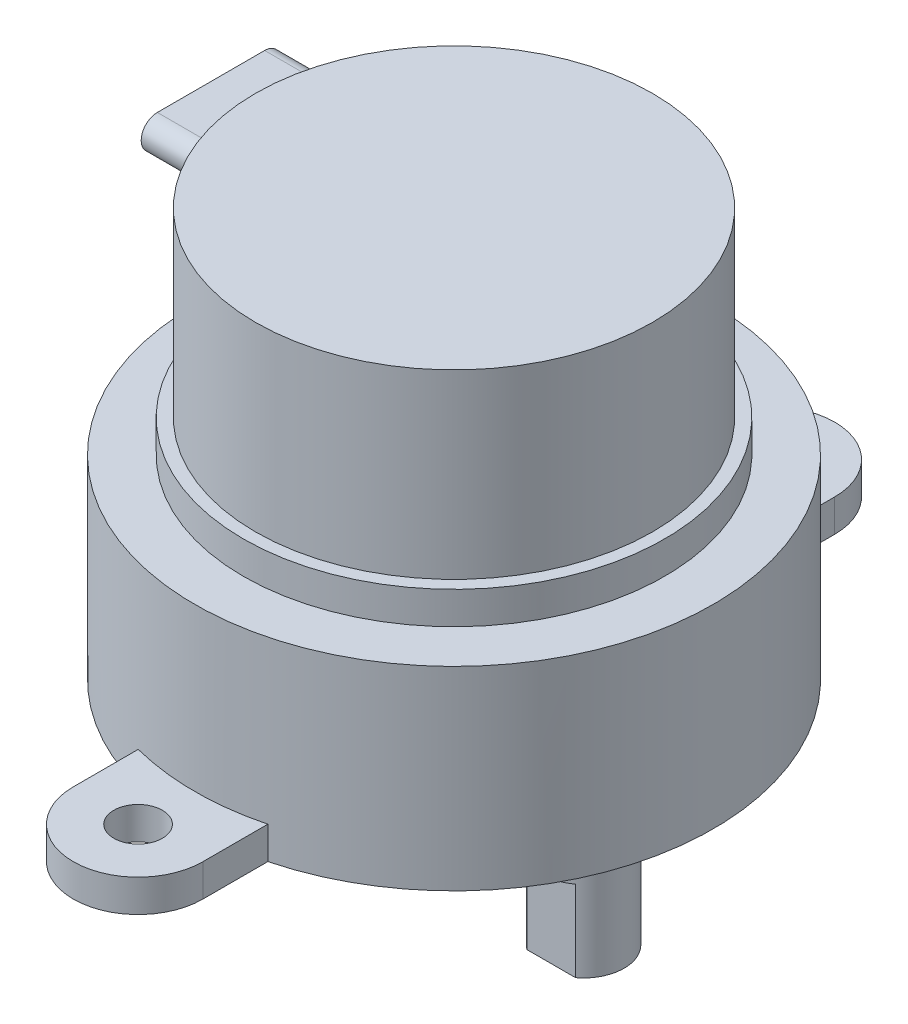
from build123d import *

# Parameters (mm, degrees)
SKETCH_9_W          = 5.698212476
SKETCH_9_H          = 1.620294685
SKETCH_9_W_2        = 7.400009417
SKETCH_9_H_2        = 3.482357373
CUT_EXTRUDE_1_DEPTH = 5
SKETCH_10_R         = 1.5
EXTRUDE_5_DEPTH     = 2
EXTRUDE_6_DEPTH     = 15


with BuildPart() as part:
    # 草图3 → 旋转1 (revolve)
    with BuildSketch(Plane.XY, mode=Mode.PRIVATE) as revolve_1_sk:
        Polygon((-16, 0), (-16, 12), (-13, 12), (-13, 14), (-12.25, 14), (-12.25, 25.2), (0, 25.2), (0, 0), align=None)
    revolve(revolve_1_sk.sketch.rotate(Axis((0, 0, 0), (0, 1, 0)), 270), axis=Axis((0, 0, 0), (0, 1, 0)))



with BuildPart() as body_2:
    # 草图6 → 旋转4 (revolve)
    with BuildSketch(Plane.XY):
        Polygon((3.5, 0), (3.5, -1.25), (4, -1.25), (4, -2.7), (5.5, -2.7), (5.5, -10.2), (8, -10.2), (8, -5.2), (8, 0), align=None)
    revolve(axis=Axis((8, 0, 0), (0, -1, 0)))

    # 草图8 → M3 螺纹孔1 (revolve, cut)
    with BuildSketch(Plane(origin=(8, -10.2, 0), x_dir=(0, 0, -1), z_dir=(1, 0, 0))):
        Polygon((0, 0), (0, 8.251075774), (1.25, 7.5), (1.25, 0), align=None)
    revolve(axis=Axis((8, -16.55, 0), (0, 1, 0)), mode=Mode.SUBTRACT)

    # 草图9 → 切除-拉伸1 (cut)
    with BuildSketch(Plane.XZ.offset(10.2)):
        with Locations((8.176379841, 2.810147343)):
            Rectangle(SKETCH_9_W, SKETCH_9_H)
        with Locations((7.325481371, -3.741178687)):
            Rectangle(SKETCH_9_W_2, SKETCH_9_H_2)
    extrude(amount=-CUT_EXTRUDE_1_DEPTH, mode=Mode.SUBTRACT)


with BuildPart() as part_1:
    add(part.part)

    add(body_2.part)  # 凸台-拉伸5 merges body 2
    # 草图10 → 凸台-拉伸5 (add)
    with BuildSketch(Plane.XZ):
        with BuildLine():
            Line((-4, -19.5), (-4, 19.5))
            ThreePointArc((-4, 19.5), (0, 23.5), (4, 19.5))
            Line((4, 19.5), (4, -19.5))
            ThreePointArc((4, -19.5), (0, -23.5), (-4, -19.5))
        make_face()
        with Locations(Location((0, 19.5, 0), (0, 0, 270))):
            Circle(SKETCH_10_R, mode=Mode.SUBTRACT)
        with Locations(Location((0, -19.5, 0), (0, 0, 270))):
            Circle(SKETCH_10_R, mode=Mode.SUBTRACT)
    extrude(amount=-EXTRUDE_5_DEPTH)

    # 草图11 → 凸台-拉伸6 (add)
    with BuildSketch(Plane(origin=(0, 0, 0), x_dir=(0, 0, -1), z_dir=(1, 0, 0))):
        with BuildLine():
            Line((-3.311772074, 24.45726904), (3.311772074, 24.45726904))
            ThreePointArc((3.311772074, 24.45726904), (4.30779375, 23.461247363), (3.311772074, 22.465225687))
            Line((3.311772074, 22.465225687), (-3.311772074, 22.465225687))
            ThreePointArc((-3.311772074, 22.465225687), (-4.30779375, 23.461247363), (-3.311772074, 24.45726904))
        make_face()
    extrude(amount=-EXTRUDE_6_DEPTH)


solid = part_1.part
